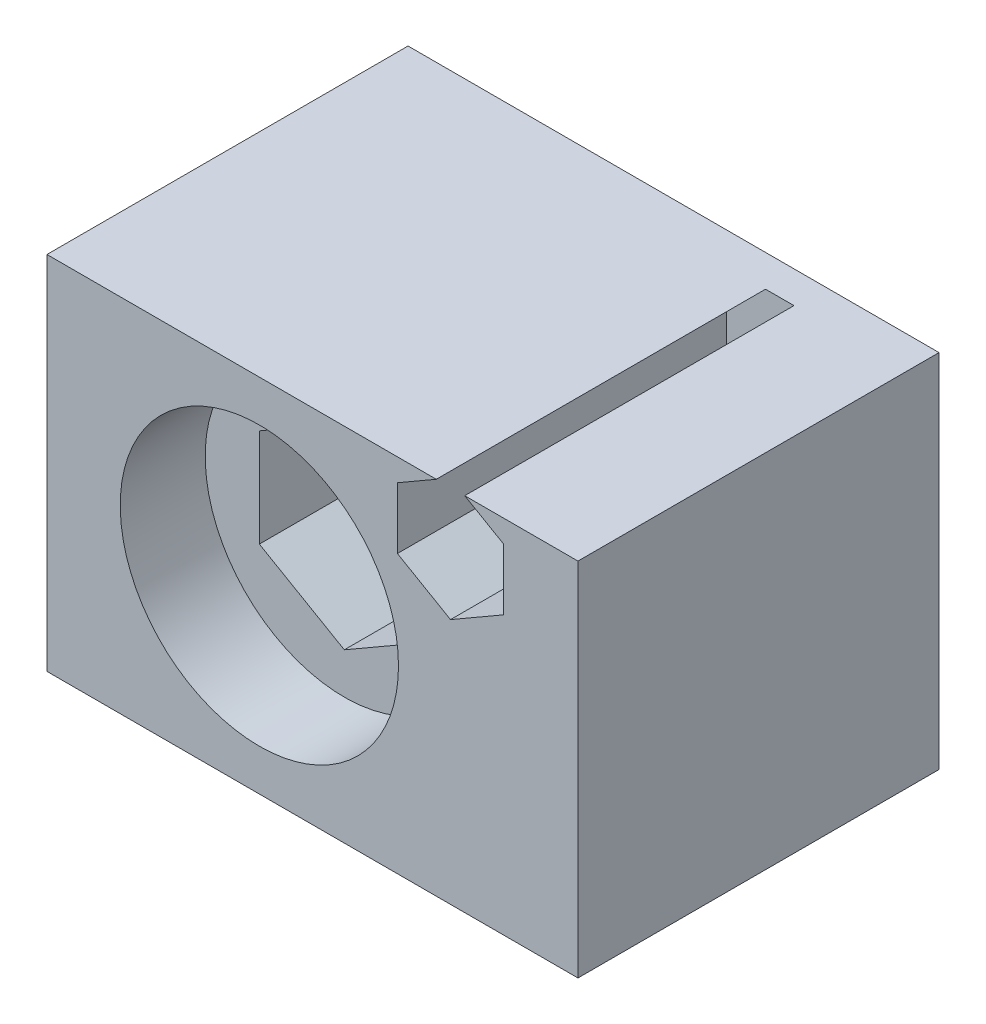
from build123d import *

# Parameters (mm, degrees)
SKETCH_1_W          = 18
SKETCH_1_H          = 18
EXTRUDE_1_DEPTH     = 25
SKETCH_2_R          = 6.55
CUT_EXTRUDE_1_DEPTH = 4.5
CUT_EXTRUDE_2_DEPTH = 11.7
CUT_EXTRUDE_3_DEPTH = 16
SKETCH_6_W          = 18
SKETCH_6_H          = 18
SKETCH_6_W_2        = 17
SKETCH_6_H_2        = 17
CUT_EXTRUDE_5_DEPTH = 36.67912555


with BuildPart() as part:
    # 草图1 → 凸台-拉伸1 (new body)
    with BuildSketch(Plane(origin=(0, 0, 0), x_dir=(0, 0, -1), z_dir=(1, 0, 0))):
        with Locations((9, 9)):
            Rectangle(SKETCH_1_W, SKETCH_1_H)
    extrude(amount=EXTRUDE_1_DEPTH)

    # 草图2 → 切除-拉伸1 (cut)
    with BuildSketch(Plane.XY):
        with Locations((10, 9)):
            Circle(SKETCH_2_R)
    extrude(amount=-CUT_EXTRUDE_1_DEPTH, mode=Mode.SUBTRACT)

    # 草图3 → 切除-拉伸2 (cut)
    with BuildSketch(Plane.XY.offset(-4.5)):
        Polygon((10, 13.618802154), (6, 11.309401077), (6, 6.690598923), (10, 4.381197846), (14, 6.690598923), (14, 11.309401077), align=None)
    extrude(amount=-CUT_EXTRUDE_2_DEPTH, mode=Mode.SUBTRACT)

    # 草图4 → 切除-拉伸3 (cut)
    with BuildSketch(Plane.XY):
        Polygon((19, 17.886751346), (16.5, 16.443375673), (16.5, 13.556624327), (19, 12.113248654), (21.5, 13.556624327), (21.5, 16.443375673), align=None)
    extrude(amount=-CUT_EXTRUDE_3_DEPTH, mode=Mode.SUBTRACT)

    # 草图6 → 切除-拉伸5 (cut, through all)
    with BuildSketch(Plane.ZY):
        with Locations((-9, 9)):
            Rectangle(SKETCH_6_W, SKETCH_6_H)
        with Locations((-9, 9)):
            Rectangle(SKETCH_6_W_2, SKETCH_6_H_2, mode=Mode.SUBTRACT)
    extrude(amount=-CUT_EXTRUDE_5_DEPTH, mode=Mode.SUBTRACT)


solid = part.part
